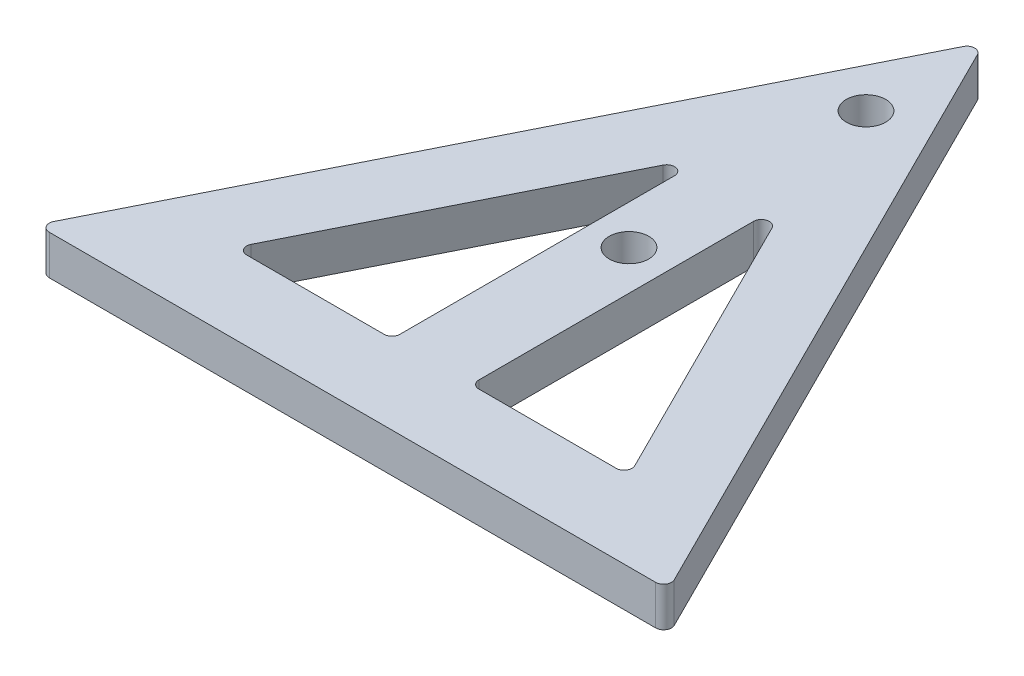
from build123d import *

# Parameters (mm, degrees)
BOSS_EXTRUDE1_DEPTH = 12.7
SKETCH2_R           = 6.35
CUT_EXTRUDE5_DEPTH  = 12.7
FILLET1_R           = 2.54
FILLET2_R           = 2.54
SKETCH3_R           = 6.35
CUT_EXTRUDE6_DEPTH  = 12.7


with BuildPart() as part:
    # Sketch1 → Boss-Extrude1 (new body)
    with BuildSketch(Plane(origin=(0, 0, 0), x_dir=(1, 0, 0), z_dir=(0, 1, 0))):
        Polygon((0, 0), (203.2, 0), (101.6, 203.197957893), align=None)
    extrude(amount=BOSS_EXTRUDE1_DEPTH)

    # Sketch2 → Cut-Extrude5 (cut)
    with BuildSketch(Plane(origin=(0, 0, 0), x_dir=(1, 0, 0), z_dir=(0, 1, 0))):
        with Locations(Location((101.6, 165.097957893, 0), (0, 0, 270))):
            Circle(SKETCH2_R)
        Polygon((38.1, 25.4), (88.9, 25.4), (88.9, 127), align=None)
        Polygon((165.1, 25.4), (114.3, 25.4), (114.3, 127), align=None)
    extrude(amount=CUT_EXTRUDE5_DEPTH, mode=Mode.SUBTRACT)

    # Fillet1
    fillet1_edges = [part.edges().sort_by_distance(p)[0] for p in [
        (101.6, 6.35, -203.197957893),
        (203.2, 6.35, 0),
        (0, 6.35, 0),
    ]]
    fillet(fillet1_edges, radius=FILLET1_R)

    # Fillet2
    fillet2_edges = [part.edges().sort_by_distance(p)[0] for p in [
        (38.1, 6.35, -25.4),
        (88.9, 6.35, -25.4),
        (88.9, 6.35, -127),
        (165.1, 6.35, -25.4),
        (114.3, 6.35, -127),
        (114.3, 6.35, -25.4),
    ]]
    fillet(fillet2_edges, radius=FILLET2_R)

    # Sketch3 → Cut-Extrude6 (cut)
    with BuildSketch(Plane(origin=(0, 12.7, 0), x_dir=(1, 0, 0), z_dir=(0, 1, 0))):
        with Locations(Location((101.6, 88.9, 0), (0, 0, 270))):
            Circle(SKETCH3_R)
    extrude(amount=-CUT_EXTRUDE6_DEPTH, mode=Mode.SUBTRACT)


solid = part.part
